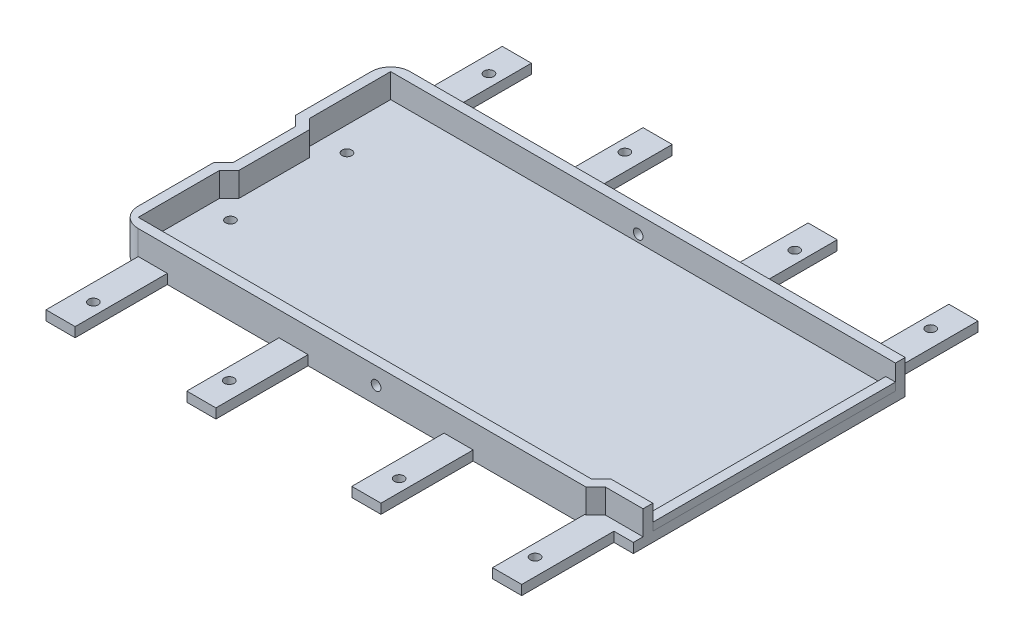
from build123d import *

# Parameters (mm, degrees)
SALIENTE_EXTRUIR1_DEPTH    = 5
CROQUIS1_3_W               = 2
CROQUIS1_3_H               = 50
SALIENTE_EXTRUIR2_DEPTH    = 1.6
CROQUIS1_4_R               = 1
SALIENTE_EXTRUIR3_DEPTH    = 3
SALIENTE_EXTRUIR3_2_DEPTH  = 3
SALIENTE_EXTRUIR5_DEPTH    = 2
CROQUIS2_W                 = 6
CROQUIS2_H                 = 19
CROQUIS2_R                 = 1
SALIENTE_EXTRUIR6_DEPTH    = 2
CROQUIS3_R                 = 1
CORTAR_EXTRUIR2_DEPTH      = 2
CORTAR_EXTRUIR3_START      = -56
CROQUIS3_2_R               = 1
CORTAR_EXTRUIR3_DEPTH      = 2
REDONDEO1_R                = 4
CROQUIS4_R                 = 4
CORTAR_EXTRUIR4_DEPTH      = 1
CORTAR_EXTRUIR5_DEPTH      = 126.769630674
CORTAR_EXTRUIR5_DEPTH_BACK = 126.769630674
CROQUIS1_7_R               = 1


with BuildPart() as part:
    # Croquis1 → Saliente-Extruir1 (new body)
    with BuildSketch(Plane(origin=(0, 0, 0), x_dir=(1, 0, 0), z_dir=(0, 1, 0))):
        Polygon((103, 51), (103, 53), (-3, 53), (-3, 33.42402598), (-1, 31.42402598), (-1, 18.57597402), (-3, 16.57597402), (-3, -3), (93.242640687, -3), (95.242640687, -1), (103, -1), (103, 1), (101, 1), (94.414213562, 1), (92.414213562, -1), (-1, -1), (-1, 15.747546896), (1, 17.747546896), (1, 32.252453104), (-1, 34.252453104), (-1, 51), (101, 51), align=None)
    extrude(amount=SALIENTE_EXTRUIR1_DEPTH)



with BuildPart() as body_2:
    # Croquis1<3> → Saliente-Extruir2 (new body)
    with BuildSketch(Plane(origin=(0, 0, 0), x_dir=(1, 0, 0), z_dir=(0, 1, 0))):
        with Locations((102, 26)):
            Rectangle(CROQUIS1_3_W, CROQUIS1_3_H)
    extrude(amount=SALIENTE_EXTRUIR2_DEPTH)


with BuildPart() as body_3:
    # Croquis1<4> → Saliente-Extruir3 (new body)
    with BuildSketch(Plane(origin=(0, 0, 0), x_dir=(1, 0, 0), z_dir=(0, 1, 0))):
        with Locations(Location((4, 13, 0), (0, 0, 270))):
            Circle(CROQUIS1_4_R)
    extrude(amount=SALIENTE_EXTRUIR3_DEPTH)


with BuildPart() as body_4:
    # Croquis1<4> → Saliente-Extruir3 2 (new body)
    with BuildSketch(Plane(origin=(0, 0, 0), x_dir=(1, 0, 0), z_dir=(0, 1, 0))):
        with Locations(Location((4, 37, 0), (0, 0, 270))):
            Circle(CROQUIS1_4_R)
    extrude(amount=SALIENTE_EXTRUIR3_2_DEPTH)


with BuildPart() as part_1:
    add(part.part)

    add(body_4.part)  # Saliente-Extruir5 merges body 4
    # Croquis1<6> → Saliente-Extruir5 (add)
    with BuildSketch(Plane(origin=(0, 0, 0), x_dir=(1, 0, 0), z_dir=(0, 1, 0))):
        Polygon((103, 53), (-3, 53), (-3, 33.42402598), (-1, 31.42402598), (-1, 18.57597402), (-3, 16.57597402), (-3, -3), (103, -3), align=None)
    extrude(amount=-SALIENTE_EXTRUIR5_DEPTH)

    # Croquis2 → Saliente-Extruir6 (add)
    # profile 1 of 8: a face of its own
    with BuildSketch(Plane.XZ.offset(2)):
        with Locations((96, -62.5)):
            Rectangle(CROQUIS2_W, CROQUIS2_H)
        with Locations(Location((95.5, -65.75, 0), (0, 0, 270))):
            Circle(CROQUIS2_R, mode=Mode.SUBTRACT)
    # profile 2 of 8: a face of its own
    with BuildSketch(Plane.XZ.offset(2)):
        with Locations((67, -62.5)):
            Rectangle(CROQUIS2_W, CROQUIS2_H)
        with Locations(Location((67.5, -65.75, 0), (0, 0, 90))):
            Circle(CROQUIS2_R, mode=Mode.SUBTRACT)
    # profile 3 of 8: a face of its own
    with BuildSketch(Plane.XZ.offset(2)):
        with Locations((33, -62.5)):
            Rectangle(CROQUIS2_W, CROQUIS2_H)
        with Locations(Location((32.5, -65.75, 0), (0, 0, 270))):
            Circle(CROQUIS2_R, mode=Mode.SUBTRACT)
    # profile 4 of 8: a face of its own
    with BuildSketch(Plane.XZ.offset(2)):
        with Locations((4, -62.5)):
            Rectangle(CROQUIS2_W, CROQUIS2_H)
        with Locations(Location((4.5, -65.75, 0), (0, 0, 90))):
            Circle(CROQUIS2_R, mode=Mode.SUBTRACT)
    # profile 5 of 8: a face of its own
    with BuildSketch(Plane.XZ.offset(2)):
        with Locations((4, 12.5)):
            Rectangle(CROQUIS2_W, CROQUIS2_H)
        with Locations(Location((4.5, 15.75, 0), (0, 0, 270))):
            Circle(CROQUIS2_R, mode=Mode.SUBTRACT)
    # profile 6 of 8: a face of its own
    with BuildSketch(Plane.XZ.offset(2)):
        with Locations((33, 12.5)):
            Rectangle(CROQUIS2_W, CROQUIS2_H)
        with Locations(Location((32.5, 15.75, 0), (0, 0, 90))):
            Circle(CROQUIS2_R, mode=Mode.SUBTRACT)
    # profile 7 of 8: a face of its own
    with BuildSketch(Plane.XZ.offset(2)):
        with Locations((67, 12.5)):
            Rectangle(CROQUIS2_W, CROQUIS2_H)
        with Locations(Location((67.5, 15.75, 0), (0, 0, 270))):
            Circle(CROQUIS2_R, mode=Mode.SUBTRACT)
    # profile 8 of 8: a face of its own
    with BuildSketch(Plane.XZ.offset(2)):
        with Locations((96, 12.5)):
            Rectangle(CROQUIS2_W, CROQUIS2_H)
        with Locations(Location((95.5, 15.75, 0), (0, 0, 90))):
            Circle(CROQUIS2_R, mode=Mode.SUBTRACT)
    extrude(amount=-SALIENTE_EXTRUIR6_DEPTH)

    # Croquis3 → Cortar-Extruir2 (cut)
    with BuildSketch(Plane.XY.offset(3)):
        with Locations((50, 1.5)):
            Circle(CROQUIS3_R)
    extrude(amount=-CORTAR_EXTRUIR2_DEPTH, mode=Mode.SUBTRACT)

    # Croquis3<2> → Cortar-Extruir3 (cut)
    with BuildSketch(Plane.XY.offset(3).offset(CORTAR_EXTRUIR3_START)):
        with Locations((50, 1.5)):
            Circle(CROQUIS3_2_R)
    extrude(amount=CORTAR_EXTRUIR3_DEPTH, mode=Mode.SUBTRACT)

    # Redondeo1
    redondeo1_edges = [part_1.edges().sort_by_distance(p)[0] for p in [
        (-3, 1.5, 3),
        (-3, 1.5, -53),
    ]]
    fillet(redondeo1_edges, radius=REDONDEO1_R)

    # Croquis4 → Cortar-Extruir4 (cut)
    with BuildSketch(Plane.XZ.offset(2)):
        with Locations(Location((18.5, -25, 0), (0, 0, 270))):
            Circle(CROQUIS4_R)
        with Locations(Location((81.5, -25, 0), (0, 0, 270))):
            Circle(CROQUIS4_R)
    extrude(amount=-CORTAR_EXTRUIR4_DEPTH, mode=Mode.SUBTRACT)


with BuildPart() as cortar_extruir5_tool:
    # Croquis1<7> → Cortar-Extruir5 (new, two sides: drawn at the far end of the back side and taken through both)
    with BuildSketch(Plane(origin=(0, 0, 0), x_dir=(1, 0, 0), z_dir=(0, 1, 0)).offset(-CORTAR_EXTRUIR5_DEPTH_BACK)):
        with Locations(Location((4, 13, 0), (0, 0, 270))):
            Circle(CROQUIS1_7_R)
        with Locations(Location((4, 37, 0), (0, 0, 270))):
            Circle(CROQUIS1_7_R)
    extrude(amount=CORTAR_EXTRUIR5_DEPTH + CORTAR_EXTRUIR5_DEPTH_BACK)


with BuildPart() as part_2:
    add(part_1.part)

    # Cortar-Extruir5: cut by cortar_extruir5_tool
    add(cortar_extruir5_tool.part, mode=Mode.SUBTRACT)


with BuildPart() as body_3_1:
    add(body_3.part)

    # Cortar-Extruir5: cut by cortar_extruir5_tool
    add(cortar_extruir5_tool.part, mode=Mode.SUBTRACT)


solid = Compound([body_2.part, part_2.part])
